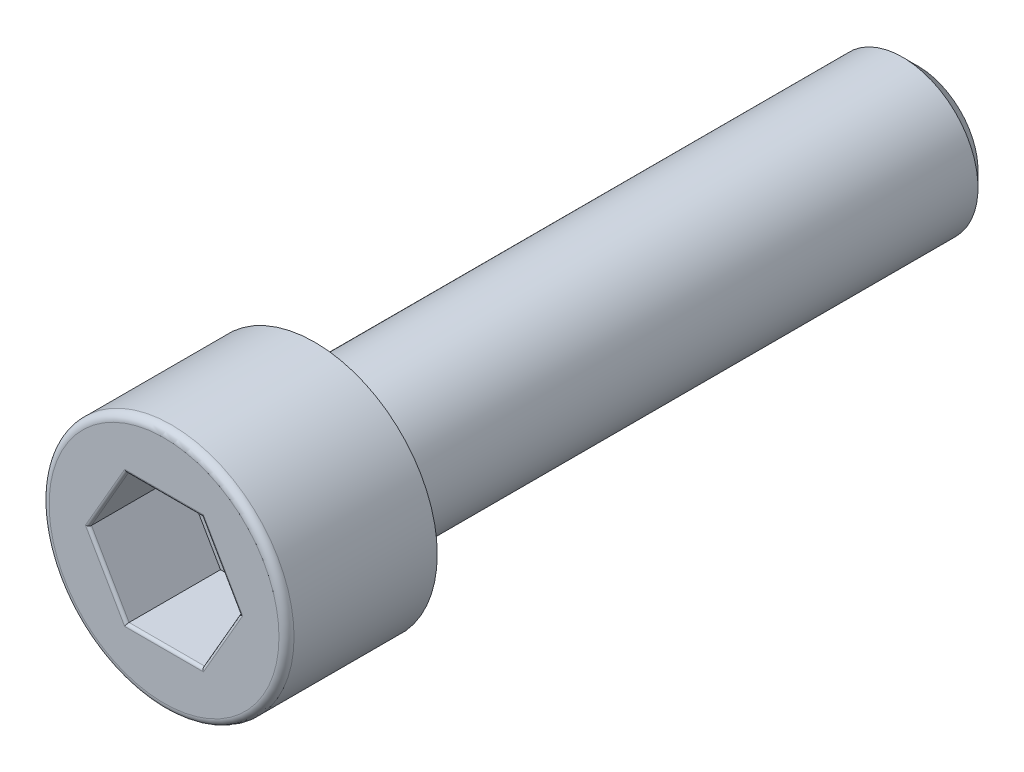
from build123d import *

# Parameters (mm, degrees)
ESQUISSE1_R             = 6.5
BASE_EXTRUSION_DEPTH    = 8
ENL_V_MAT_EXTRU_1_DEPTH = 5
CONG_1_R                = 0.4
CONG_2_R                = 0.15
ESQUISSE3_R             = 4
BOSS_EXTRU_1_DEPTH      = 32
CHANFREIN1_SIZE         = 0.8


with BuildPart() as part:
    # Esquisse1 → Base-Extrusion (new body)
    with BuildSketch(Plane.XY):
        Circle(ESQUISSE1_R)
    extrude(amount=BASE_EXTRUSION_DEPTH)

    # Esquisse2 → Enlèv. mat.-Extru.1 (cut)
    with BuildSketch(Plane.XY.offset(8)):
        Polygon((-4, 0), (-2.004145082, 3.461705142), (2.004145082, 3.461705142), (4, 0), (2.004145082, -3.461705142), (-2.004145082, -3.461705142), align=None)
    extrude(amount=-ENL_V_MAT_EXTRU_1_DEPTH, mode=Mode.SUBTRACT)

    # Congé1
    cong_1_edges = [part.edges().sort_by_distance(p)[0] for p in [
        (-6.5, 0, 8),
    ]]
    fillet(cong_1_edges, radius=CONG_1_R)

    # Congé2
    cong_2_edges = [part.edges().sort_by_distance(p)[0] for p in [
        (-3.002072541, -1.730852571, 8),
        (0, -3.461705142, 8),
        (3.002072541, -1.730852571, 8),
        (3.002072541, 1.730852571, 8),
        (0, 3.461705142, 8),
        (-3.002072541, 1.730852571, 8),
    ]]
    fillet(cong_2_edges, radius=CONG_2_R)

    # Esquisse3 → Boss.-Extru.1 (add)
    with BuildSketch(Plane(origin=(0, 0, 0), x_dir=(-1, 0, 0), z_dir=(0, 0, -1))):
        Circle(ESQUISSE3_R)
    extrude(amount=BOSS_EXTRU_1_DEPTH)

    # Chanfrein1
    chanfrein1_edges = [part.edges().sort_by_distance(p)[0] for p in [
        (4, 0, -32),
    ]]
    chamfer(chanfrein1_edges, length=CHANFREIN1_SIZE)


solid = part.part
